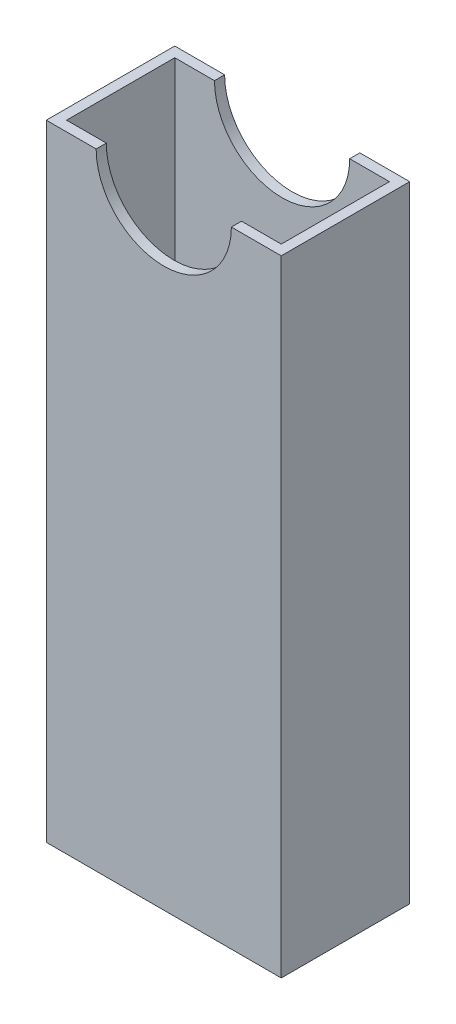
from build123d import *

# Parameters (mm, degrees)
SKETCH1_W           = 34.75
SKETCH1_H           = 19
SKETCH1_W_2         = 31.75
SKETCH1_H_2         = 16
BOSS_EXTRUDE1_DEPTH = 1.5
SKETCH2_W           = 34.75
SKETCH2_H           = 19
SKETCH2_W_2         = 31.75
SKETCH2_H_2         = 16
BOSS_EXTRUDE2_DEPTH = 91
CUT_EXTRUDE1_REACH  = 98.016


with BuildPart() as part:
    # Sketch1 → Boss-Extrude1 (new body)
    # profile 1 of 2: a face of its own
    with BuildSketch(Plane(origin=(0, 0, 0), x_dir=(1, 0, 0), z_dir=(0, 1, 0))):
        Rectangle(SKETCH1_W, SKETCH1_H)
        Rectangle(SKETCH1_W_2, SKETCH1_H_2, mode=Mode.SUBTRACT)
    # profile 2 of 2: a face of its own
    with BuildSketch(Plane(origin=(0, 0, 0), x_dir=(1, 0, 0), z_dir=(0, 1, 0))):
        Rectangle(SKETCH1_W_2, SKETCH1_H_2)
    extrude(amount=BOSS_EXTRUDE1_DEPTH)

    # Sketch2 → Boss-Extrude2 (add)
    with BuildSketch(Plane(origin=(0, 1.5, 0), x_dir=(1, 0, 0), z_dir=(0, 1, 0))):
        Rectangle(SKETCH2_W, SKETCH2_H)
        Rectangle(SKETCH2_W_2, SKETCH2_H_2, mode=Mode.SUBTRACT)
    extrude(amount=BOSS_EXTRUDE2_DEPTH)

    # Cut-Extrude1: up to this face of the body (flat: up to its plane)
    cut_extrude1_end = Plane(part.part.faces().sort_by_distance((0, 46.25, -9.5))[0])
    # Sketch3 → Cut-Extrude1 (cut, up to the picked face)
    with BuildSketch(Plane.XY.offset(9.5), mode=Mode.PRIVATE) as cut_extrude1_sk1:
        with BuildLine():
            Line((10, 92.5), (0, 92.5))
            Line((0, 92.5), (0, 82.5))
            ThreePointArc((0, 82.5), (7.071067812, 85.428932188), (10, 92.5))
        make_face()
    cut_extrude1_tool1 = split(extrude(cut_extrude1_sk1.sketch, amount=-CUT_EXTRUDE1_REACH, mode=Mode.PRIVATE), bisect_by=cut_extrude1_end, keep=Keep.BOTH, mode=Mode.PRIVATE)
    # Sketch3 → Cut-Extrude1 (cut, up to the picked face)
    with BuildSketch(Plane.XY.offset(9.5), mode=Mode.PRIVATE) as cut_extrude1_sk2:
        with BuildLine():
            Line((0, 82.5), (0, 92.5))
            Line((0, 92.5), (-10, 92.5))
            ThreePointArc((-10, 92.5), (-7.071067812, 85.428932188), (0, 82.5))
        make_face()
    cut_extrude1_tool2 = split(extrude(cut_extrude1_sk2.sketch, amount=-CUT_EXTRUDE1_REACH, mode=Mode.PRIVATE), bisect_by=cut_extrude1_end, keep=Keep.BOTH, mode=Mode.PRIVATE)
    # Sketch3 → Cut-Extrude1 (cut, up to the picked face)
    with BuildSketch(Plane.XY.offset(9.5), mode=Mode.PRIVATE) as cut_extrude1_sk3:
        with BuildLine():
            Line((10, 92.5), (0, 92.5))
            Line((0, 92.5), (0, 82.5))
            ThreePointArc((0, 82.5), (7.071067812, 85.428932188), (10, 92.5))
        make_face()
    cut_extrude1_tool3 = split(extrude(cut_extrude1_sk3.sketch, amount=-CUT_EXTRUDE1_REACH, mode=Mode.PRIVATE), bisect_by=cut_extrude1_end, keep=Keep.BOTH, mode=Mode.PRIVATE)
    # Sketch3 → Cut-Extrude1 (cut, up to the picked face)
    with BuildSketch(Plane.XY.offset(9.5), mode=Mode.PRIVATE) as cut_extrude1_sk4:
        with BuildLine():
            Line((0, 82.5), (0, 92.5))
            Line((0, 92.5), (-10, 92.5))
            ThreePointArc((-10, 92.5), (-7.071067812, 85.428932188), (0, 82.5))
        make_face()
    cut_extrude1_tool4 = split(extrude(cut_extrude1_sk4.sketch, amount=-CUT_EXTRUDE1_REACH, mode=Mode.PRIVATE), bisect_by=cut_extrude1_end, keep=Keep.BOTH, mode=Mode.PRIVATE)
    add(cut_extrude1_tool1.solids().sort_by(Axis((4.244132, 88.255868, 9.5), (0, 0, -1)))[0], mode=Mode.SUBTRACT)
    add(cut_extrude1_tool2.solids().sort_by(Axis((-4.244132, 88.255868, 9.5), (0, 0, -1)))[0], mode=Mode.SUBTRACT)
    add(cut_extrude1_tool3.solids().sort_by(Axis((4.244132, 88.255868, 9.5), (0, 0, -1)))[0], mode=Mode.SUBTRACT)
    add(cut_extrude1_tool4.solids().sort_by(Axis((-4.244132, 88.255868, 9.5), (0, 0, -1)))[0], mode=Mode.SUBTRACT)


solid = part.part
